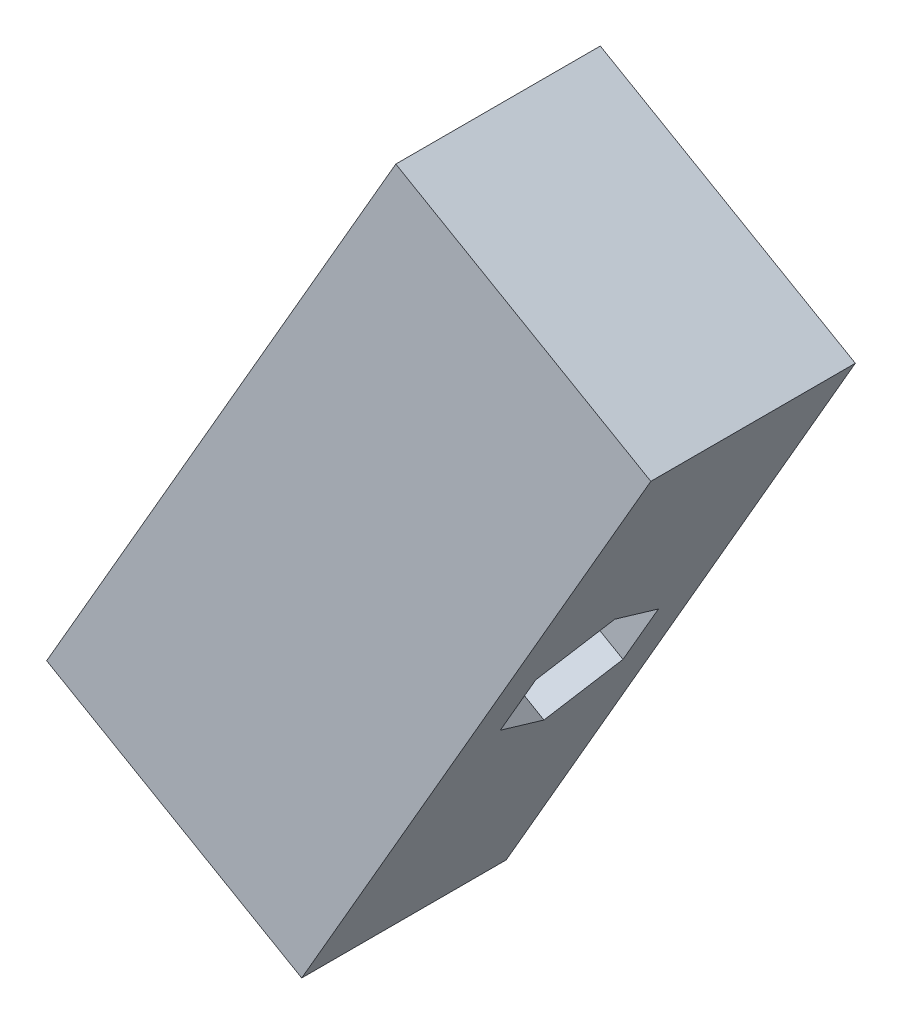
from build123d import *

# Parameters (mm, degrees)
RESSALTO_EXTRUS_O1_DEPTH = 10
ESBO_O3_R                = 1.7
CORTE_EXTRUS_O1_DEPTH    = 33.009811874
CORTE_EXTRUS_O3_START    = -11.4
ESBO_O3_4_R              = 1.7
CORTE_EXTRUS_O3_DEPTH    = 3


with BuildPart() as part:
    # Esboço2 → Ressalto-extrusão1 (new body)
    with BuildSketch(Plane.XY):
        Polygon((-49.807026949, 9.042797905), (-32.734806181, 38.612751673), (-20.264040367, 31.412751673), (-37.336261135, 1.842797905), align=None)
    extrude(amount=RESSALTO_EXTRUS_O1_DEPTH)

    # Esboço3 → Corte-extrusão1 (cut, through all)
    with BuildSketch(Plane(origin=(-41.270916565, 23.827774789, 0), x_dir=(0, 0, 1), z_dir=(-0.8660254037844386, 0.5000000000000003, 0))):
        with Locations(Location((5, 0, 0), (0, 0, 270))):
            Circle(ESBO_O3_R)
    extrude(amount=-CORTE_EXTRUS_O1_DEPTH, mode=Mode.SUBTRACT)

    # Esboço3<4> → Corte-extrusão3 (cut)
    with BuildSketch(Plane(origin=(-41.270916565, 23.827774789, 0), x_dir=(0, 0, 1), z_dir=(-0.8660254037844386, 0.5000000000000003, 0)).offset(CORTE_EXTRUS_O3_START)):
        Polygon((4.988193566, 3.524626071), (1.988193566, 1.792575264), (1.988193566, -1.671526352), (4.988193566, -3.403577159), (7.988193566, -1.671526352), (7.988193566, 1.792575264), align=None)
        with Locations(Location((5, 0, 0), (0, 0, 270))):
            Circle(ESBO_O3_4_R, mode=Mode.SUBTRACT)
    extrude(amount=-CORTE_EXTRUS_O3_DEPTH, mode=Mode.SUBTRACT)


solid = part.part
